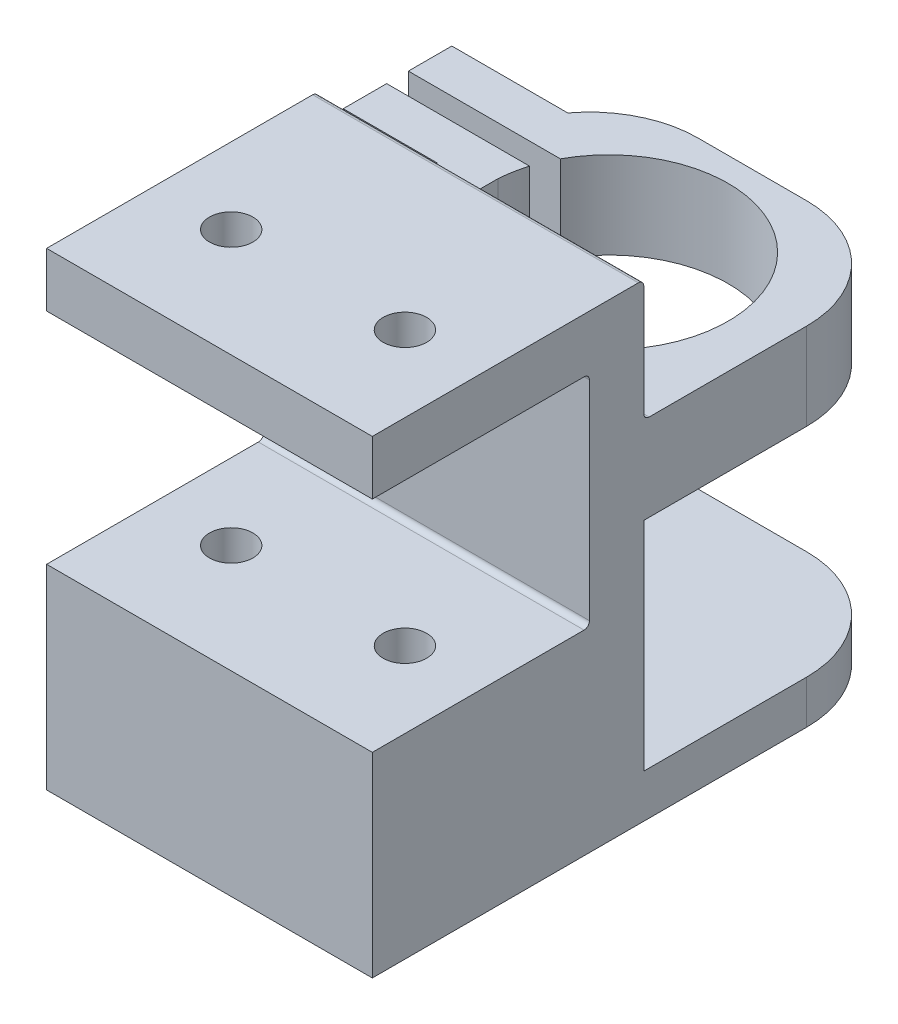
from build123d import *

# Parameters (mm, degrees)
SKETCH2_W               = 30
SKETCH2_H               = 8
SKETCH2_W_2             = 20
SKETCH2_H_2             = 5
BOSS_EXTRUDE1_DEPTH     = 30
SKETCH3_R               = 11
CUT_EXTRUDE1_DEPTH      = 55.626001135
FILLET1_R               = 10
FILLET2_R               = 0.5
SKETCH4_R               = 2
CUT_EXTRUDE2_DEPTH      = 61.018663764
SKETCH5_W               = 6
SKETCH5_H               = 2
CUT_EXTRUDE3_DEPTH      = 55.626001135
SKETCH6_W               = 14
SKETCH6_H               = 4
SKETCH6_W_2             = 12.707178849
BOSS_EXTRUDE2_DEPTH     = 8
CUT_EXTRUDE4_DEPTH      = 58.823956973
CUT_EXTRUDE4_DEPTH_BACK = 58.823956973
SKETCH7_R               = 1.5
SKETCH8_W               = 30
SKETCH8_H               = 25
SKETCH8_R               = 2
BOSS_EXTRUDE3_DEPTH     = 6
SKETCH9_R               = 2
BOSS_EXTRUDE4_DEPTH     = 4


with BuildPart() as part:
    # Sketch2 → Boss-Extrude1 (new body)
    with BuildSketch(Plane(origin=(0, 0, 0), x_dir=(0, 0, -1), z_dir=(1, 0, 0))):
        with Locations((25, -0.1)):
            Rectangle(SKETCH2_W, SKETCH2_H)
        Polygon((10, 15.1), (10, 10.1), (10, 3.9), (15, 3.9), (15, 15.1), align=None)
        with Locations((0, 12.6)):
            Rectangle(SKETCH2_W_2, SKETCH2_H_2)
        with Locations((0, -14.1)):
            Rectangle(SKETCH2_W_2, SKETCH2_H)
        Polygon((15, -4.1), (10, -4.1), (10, -10.1), (10, -18.1), (15, -18.1), align=None)
    extrude(amount=BOSS_EXTRUDE1_DEPTH)

    # Sketch3 → Cut-Extrude1 (cut, through all)
    with BuildSketch(Plane(origin=(0, 3.9, 0), x_dir=(1, 0, 0), z_dir=(0, 1, 0))):
        with Locations(Location((15, 26.775, 0), (0, 0, 270))):
            Circle(SKETCH3_R)
    extrude(amount=-CUT_EXTRUDE1_DEPTH, mode=Mode.SUBTRACT)

    # Fillet1
    fillet1_edges = [part.edges().sort_by_distance(p)[0] for p in [
        (0, -0.1, -40),
        (30, -0.1, -40),
    ]]
    fillet(fillet1_edges, radius=FILLET1_R)

    # Fillet2
    fillet2_edges = [part.edges().sort_by_distance(p)[0] for p in [
        (15, -10.1, -10),
        (15, 10.1, -10),
        (15, 15.1, -15),
        (15, 3.9, -15),
    ]]
    fillet(fillet2_edges, radius=FILLET2_R)

    # Sketch4 → Cut-Extrude2 (cut, through all)
    with BuildSketch(Plane(origin=(0, 15.1, 0), x_dir=(1, 0, 0), z_dir=(0, 1, 0))):
        with Locations(Location((7, 0, 0), (0, 0, 270))):
            Circle(SKETCH4_R)
        with Locations(Location((23, 0, 0), (0, 0, 270))):
            Circle(SKETCH4_R)
    extrude(amount=-CUT_EXTRUDE2_DEPTH, mode=Mode.SUBTRACT)

    # Sketch5 → Cut-Extrude3 (cut, through all)
    with BuildSketch(Plane(origin=(0, 3.9, 0), x_dir=(1, 0, 0), z_dir=(0, 1, 0))):
        with Locations((3, 31)):
            Rectangle(SKETCH5_W, SKETCH5_H)
    extrude(amount=-CUT_EXTRUDE3_DEPTH, mode=Mode.SUBTRACT)

    # Sketch6 → Boss-Extrude2 (add)
    with BuildSketch(Plane(origin=(0, 3.9, 0), x_dir=(1, 0, 0), z_dir=(0, 1, 0))):
        with Locations((-1.679843749, 34)):
            Rectangle(SKETCH6_W, SKETCH6_H)
        with Locations((-2.326254324, 28)):
            Rectangle(SKETCH6_W_2, SKETCH6_H)
    extrude(amount=-BOSS_EXTRUDE2_DEPTH)

    # Sketch7 → Cut-Extrude4 (cut, two sides: drawn at the far end of the back side and taken through both)
    with BuildSketch(Plane(origin=(0, 0, -36), x_dir=(-1, 0, 0), z_dir=(0, 0, -1)).offset(-CUT_EXTRUDE4_DEPTH_BACK)):
        with Locations(Location((4.679843749, -0.1, 0), (0, 0, 180))):
            Circle(SKETCH7_R)
    extrude(amount=CUT_EXTRUDE4_DEPTH + CUT_EXTRUDE4_DEPTH_BACK, mode=Mode.SUBTRACT)

    # Sketch8 → Boss-Extrude3 (add)
    with BuildSketch(Plane.XZ.offset(18.1)):
        with Locations((15, -2.5)):
            Rectangle(SKETCH8_W, SKETCH8_H)
        with Locations(Location((7, 0, 0), (0, 0, 90))):
            Circle(SKETCH8_R, mode=Mode.SUBTRACT)
        with Locations(Location((23, 0, 0), (0, 0, 90))):
            Circle(SKETCH8_R, mode=Mode.SUBTRACT)
    extrude(amount=BOSS_EXTRUDE3_DEPTH)

    # Sketch9 → Boss-Extrude4 (add)
    with BuildSketch(Plane.XZ.offset(24.1)):
        with BuildLine():
            Line((0, -30), (0, -15))
            Line((0, -15), (0, 10))
            Line((0, 10), (30, 10))
            Line((30, 10), (30, -15))
            Line((30, -15), (30, -30))
            ThreePointArc((30, -30), (27.071067812, -37.071067812), (20, -40))
            Line((20, -40), (10, -40))
            ThreePointArc((10, -40), (2.928932188, -37.071067812), (0, -30))
        make_face()
        with Locations(Location((7, 0, 0), (0, 0, 90))):
            Circle(SKETCH9_R, mode=Mode.SUBTRACT)
        with Locations(Location((23, 0, 0), (0, 0, 90))):
            Circle(SKETCH9_R, mode=Mode.SUBTRACT)
    extrude(amount=BOSS_EXTRUDE4_DEPTH)


solid = part.part
